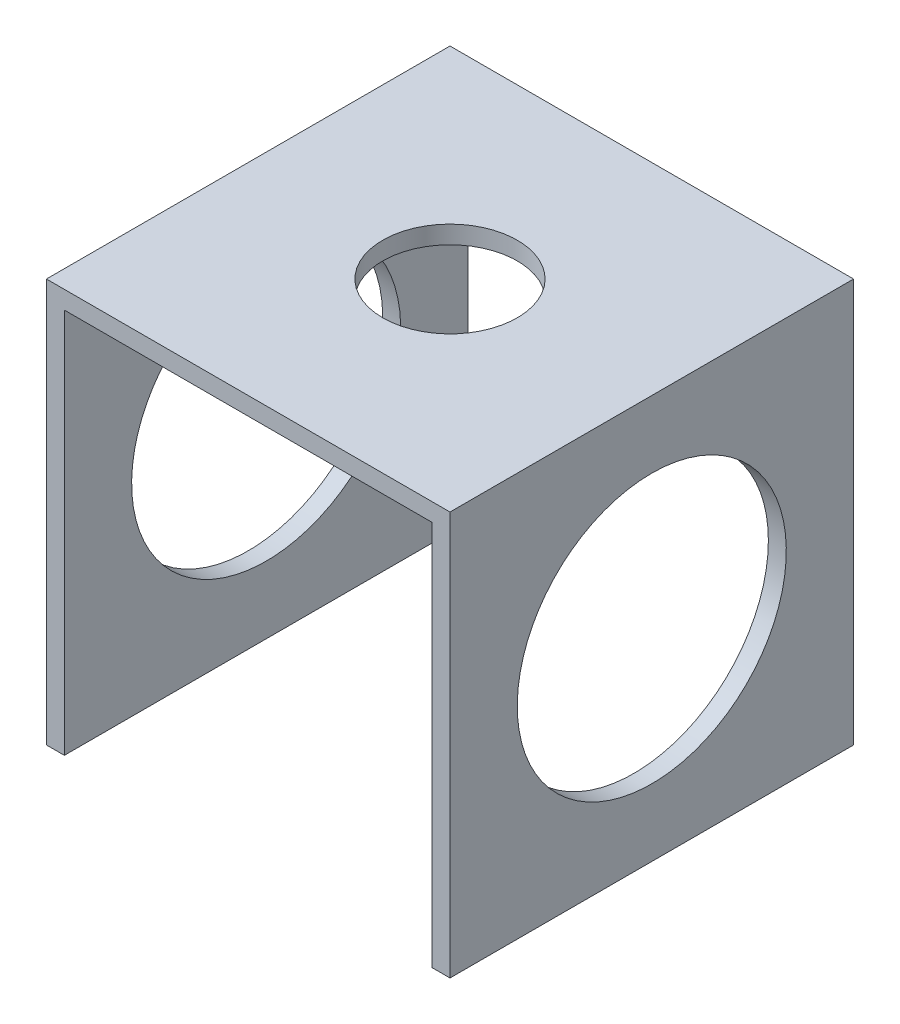
from build123d import *

# Parameters (mm, degrees)
EXTRUDE_1_DEPTH     = 180
SKETCH_2_R          = 30
CUT_EXTRUDE_1_DEPTH = 180
SKETCH_3_R          = 60
CUT_EXTRUDE_2_DEPTH = 217


with BuildPart() as part:
    # 草图1 → 凸台-拉伸1 (new body)
    with BuildSketch(Plane.XY):
        Polygon((-90, 180), (90, 180), (90, 0), (82, 0), (82, 172), (-82, 172), (-82, 0), (-90, 0), align=None)
    extrude(amount=EXTRUDE_1_DEPTH)

    # 草图2 → 切除-拉伸1 (cut)
    with BuildSketch(Plane(origin=(0, 180, 0), x_dir=(1, 0, 0), z_dir=(0, 1, 0))):
        with Locations(Location((0, -90, 0), (0, 0, 270))):
            Circle(SKETCH_2_R)
    extrude(amount=-CUT_EXTRUDE_1_DEPTH, mode=Mode.SUBTRACT)

    # 草图3 → 切除-拉伸2 (cut)
    with BuildSketch(Plane(origin=(90, 0, 0), x_dir=(0, 0, -1), z_dir=(1, 0, 0))):
        with Locations(Location((-90, 90, 0), (0, 0, 90))):
            Circle(SKETCH_3_R)
    extrude(amount=-CUT_EXTRUDE_2_DEPTH, mode=Mode.SUBTRACT)


solid = part.part
